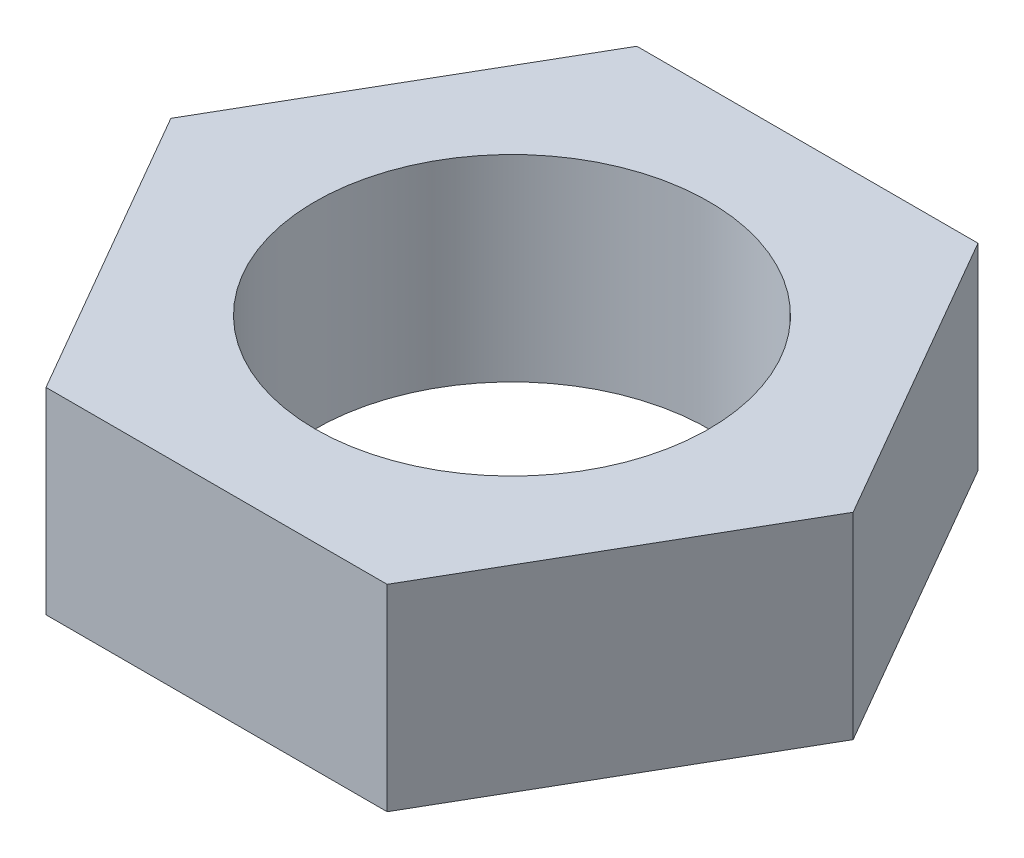
from build123d import *

# Parameters (mm, degrees)
SKETCH1_R           = 5
BOSS_EXTRUDE1_DEPTH = 5


with BuildPart() as part:
    # Sketch1 → Boss-Extrude1 (new body)
    with BuildSketch(Plane(origin=(0, 0, 0), x_dir=(1, 0, 0), z_dir=(0, 1, 0))):
        Polygon((8.660254038, 0), (4.330127019, 7.5), (-4.330127019, 7.5), (-8.660254038, 0), (-4.330127019, -7.5), (4.330127019, -7.5), align=None)
        with Locations(Location((0, 0, 0), (0, 0, 270))):
            Circle(SKETCH1_R, mode=Mode.SUBTRACT)
    extrude(amount=BOSS_EXTRUDE1_DEPTH)


solid = part.part
